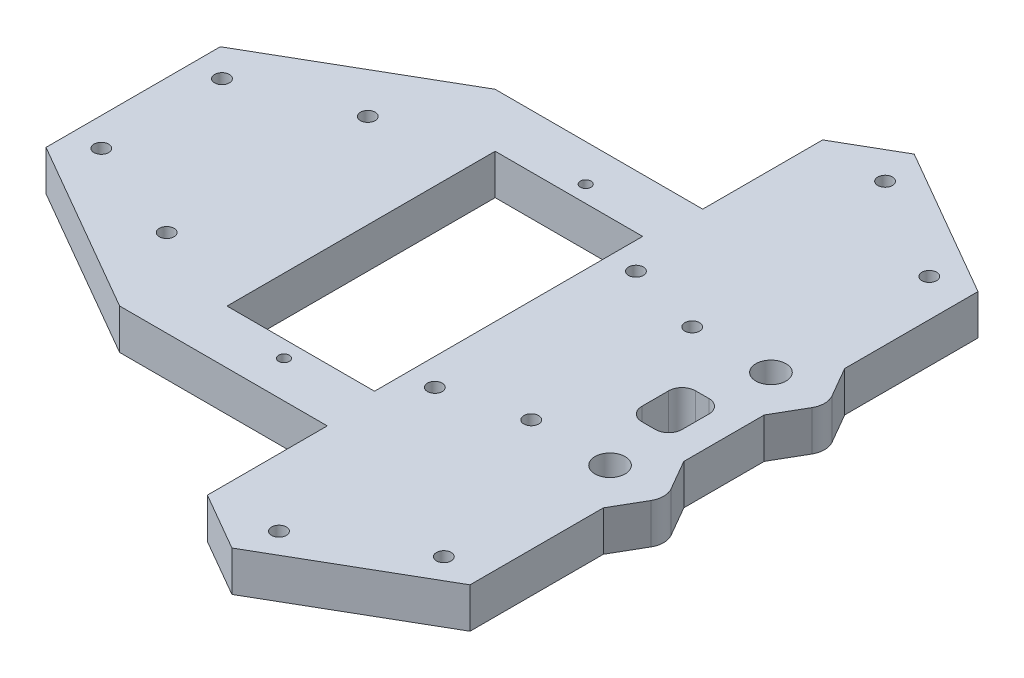
from build123d import *

# Parameters (mm, degrees)
SKETCH1_R                  = 1.1
SKETCH1_W                  = 22
SKETCH1_H                  = 40
SKETCH1_W_2                = 6
SKETCH1_H_2                = 8
BOSS_EXTRUDE1_DEPTH        = 6
F_1_6_1_6_DIAMETER_HOLE3_D = 1.6
BOSS_EXTRUDE2_DEPTH        = 6
FILLET1_R                  = 2
F_2_2_2_2_DIAMETER_HOLE1_D = 2.2
F_4_0MM_DOWEL_HOLE1_D      = 4.5
F_2_0MM_DOWEL_HOLE1_D      = 2.2


with BuildPart() as part:
    # Sketch1 → Boss-Extrude1 (new body)
    with BuildSketch(Plane(origin=(0, 0, 0), x_dir=(1, 0, 0), z_dir=(0, 1, 0))):
        Polygon((14.366669751, 50.883801944), (36.883330249, 37.883801944), (36.883330249, -37.883801944), (14.366669751, -50.883801944), (5.706415713, -45.883801944), (5.706415713, -28), (-25.269237886, -28), (-51.25, -13), (-51.25, 13), (-25.269237886, 28), (5.706415713, 28), (5.706415713, 45.883801944), align=None)
        with Locations(Location((15.705771366, 45.203193978, 0), (0, 0, 270))):
            Circle(SKETCH1_R, mode=Mode.SUBTRACT)
        with Locations(Location((31.294228634, 36.203193978, 0), (0, 0, 270))):
            Circle(SKETCH1_R, mode=Mode.SUBTRACT)
        with Locations(Location((31.294228634, -36.203193978, 0), (0, 0, 270))):
            Circle(SKETCH1_R, mode=Mode.SUBTRACT)
        with Locations(Location((15.705771366, -45.203193978, 0), (0, 0, 270))):
            Circle(SKETCH1_R, mode=Mode.SUBTRACT)
        with Locations(Location((-47, 9, 0), (0, 0, 270))):
            Circle(SKETCH1_R, mode=Mode.SUBTRACT)
        with Locations(Location((-47, -9, 0), (0, 0, 270))):
            Circle(SKETCH1_R, mode=Mode.SUBTRACT)
        with Locations((-6.25, 0)):
            Rectangle(SKETCH1_W, SKETCH1_H, mode=Mode.SUBTRACT)
        with Locations((29.633330249, 0)):
            Rectangle(SKETCH1_W_2, SKETCH1_H_2, mode=Mode.SUBTRACT)
    extrude(amount=BOSS_EXTRUDE1_DEPTH)

    # Ø1.6 (1.6) Diameter Hole3 (through all)
    with Locations(Plane(origin=(-6.25, 0, 22.5), x_dir=(0, 0, -1), z_dir=(0, -1, 0))):
        with Locations((0, 0), (45, 0)):
            Hole(F_1_6_1_6_DIAMETER_HOLE3_D / 2)

    # Sketch9 → Boss-Extrude2 (add)
    with BuildSketch(Plane.XZ):
        with BuildLine():
            Line((36.883330249, -9), (36.883330249, -15))
            ThreePointArc((36.883330249, -15), (38.383330249, -14.598076211), (39.481406461, -13.5))
            ThreePointArc((39.481406461, -13.5), (39.883330249, -12), (39.481406461, -10.5))
            ThreePointArc((39.481406461, -10.5), (38.383330249, -9.401923789), (36.883330249, -9))
        make_face()
        with BuildLine():
            Line((36.883330249, -6), (36.883330249, -9))
            ThreePointArc((36.883330249, -9), (38.383330249, -9.401923789), (39.481406461, -10.5))
            Line((39.481406461, -10.5), (36.883330249, -6))
        make_face()
        with BuildLine():
            Line((36.883330249, -15), (36.883330249, -18))
            Line((36.883330249, -18), (39.481406461, -13.5))
            ThreePointArc((39.481406461, -13.5), (38.383330249, -14.598076211), (36.883330249, -15))
        make_face()
        with BuildLine():
            ThreePointArc((39.481406461, 10.5), (39.883330249, 12), (39.481406461, 13.5))
            ThreePointArc((39.481406461, 13.5), (38.383330249, 14.598076211), (36.883330249, 15))
            Line((36.883330249, 15), (36.883330249, 9))
            ThreePointArc((36.883330249, 9), (38.383330249, 9.401923789), (39.481406461, 10.5))
        make_face()
        with BuildLine():
            Line((36.883330249, 6), (39.481406461, 10.5))
            ThreePointArc((39.481406461, 10.5), (38.383330249, 9.401923789), (36.883330249, 9))
            Line((36.883330249, 9), (36.883330249, 6))
        make_face()
        with BuildLine():
            ThreePointArc((36.883330249, 15), (38.383330249, 14.598076211), (39.481406461, 13.5))
            Line((39.481406461, 13.5), (36.883330249, 18))
            Line((36.883330249, 18), (36.883330249, 15))
        make_face()
    extrude(amount=-BOSS_EXTRUDE2_DEPTH)

    # Fillet1
    fillet1_edges = [part.edges().sort_by_distance(p)[0] for p in [
        (32.633330249, 3, 4),
        (32.633330249, 3, -4),
        (26.633330249, 3, -4),
        (26.633330249, 3, 4),
    ]]
    fillet(fillet1_edges, radius=FILLET1_R)

    # Ø2.2 (2.2) Diameter Hole1 (through all)
    with Locations(Plane(origin=(20.133330249, 6, -12), x_dir=(0, 0, 1), z_dir=(0, 1, 0))):
        with Locations((0, 0), (24, 0)):
            Hole(F_2_2_2_2_DIAMETER_HOLE1_D / 2)

    # Ø4.0mm Dowel Hole1 (through all)
    with Locations(Plane(origin=(31.883330249, 6, -12), x_dir=(0, 0, 1), z_dir=(0, 1, 0))):
        with Locations((0, 0), (24, 0)):
            Hole(F_4_0MM_DOWEL_HOLE1_D / 2)

    # Ø2.0mm Dowel Hole1 (through all)
    with Locations(Plane(origin=(-31.25, 6, -15), x_dir=(0, 0, 1), z_dir=(0, 1, 0))):
        with Locations((0, 0), (30, 0), (30, 40), (0, 40)):
            Hole(F_2_0MM_DOWEL_HOLE1_D / 2)


solid = part.part
